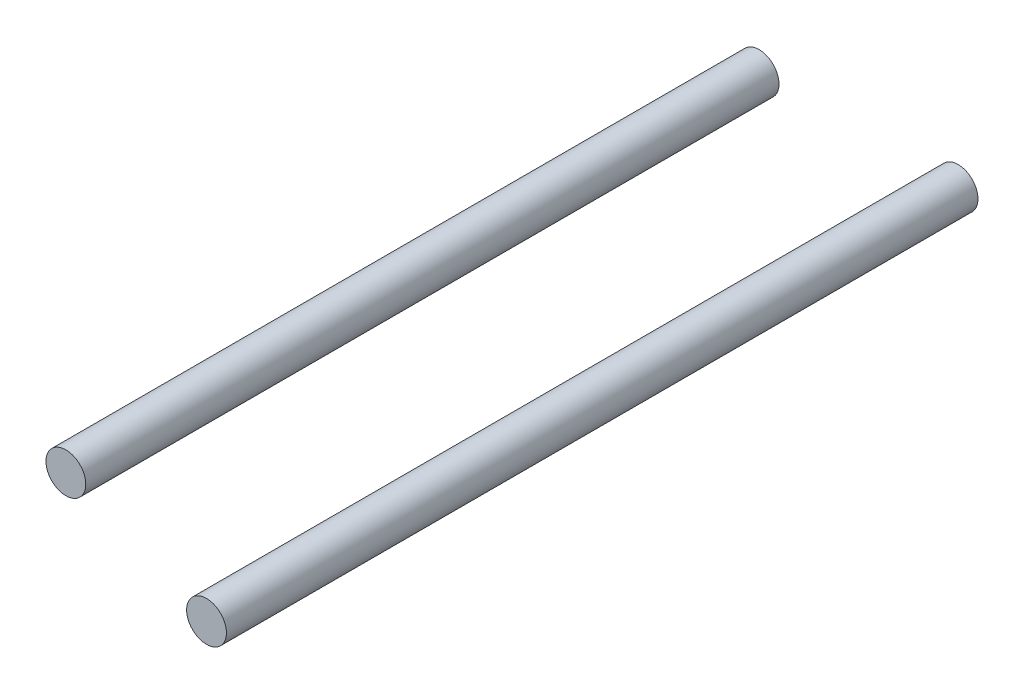
from build123d import *

# Parameters (mm, degrees)
SKETCH_1_R        = 3
EXTRUDE_1_DEPTH   = 104.5
EXTRUDE_1_2_DEPTH = 104.5
SKETCH_2_R        = 3
EXTRUDE_2_DEPTH   = 8.8


with BuildPart() as part:
    # ｽｹｯﾁ1 → ﾎﾞｽ - 押し出し1 (new body)
    with BuildSketch(Plane.XY):
        with Locations((-15, 0)):
            Circle(SKETCH_1_R)
    extrude(amount=EXTRUDE_1_DEPTH)


with BuildPart() as body_2:
    # ｽｹｯﾁ1 → Extrude 1 2 (new body)
    with BuildSketch(Plane.XY):
        with Locations((15, 0)):
            Circle(SKETCH_1_R)
    extrude(amount=EXTRUDE_1_2_DEPTH)

    # ｽｹｯﾁ2 → ﾎﾞｽ - 押し出し2 (add)
    with BuildSketch(Plane.XY.offset(104.5)):
        with Locations((15, 0)):
            Circle(SKETCH_2_R)
    extrude(amount=EXTRUDE_2_DEPTH)


solid = Compound([part.part, body_2.part])
